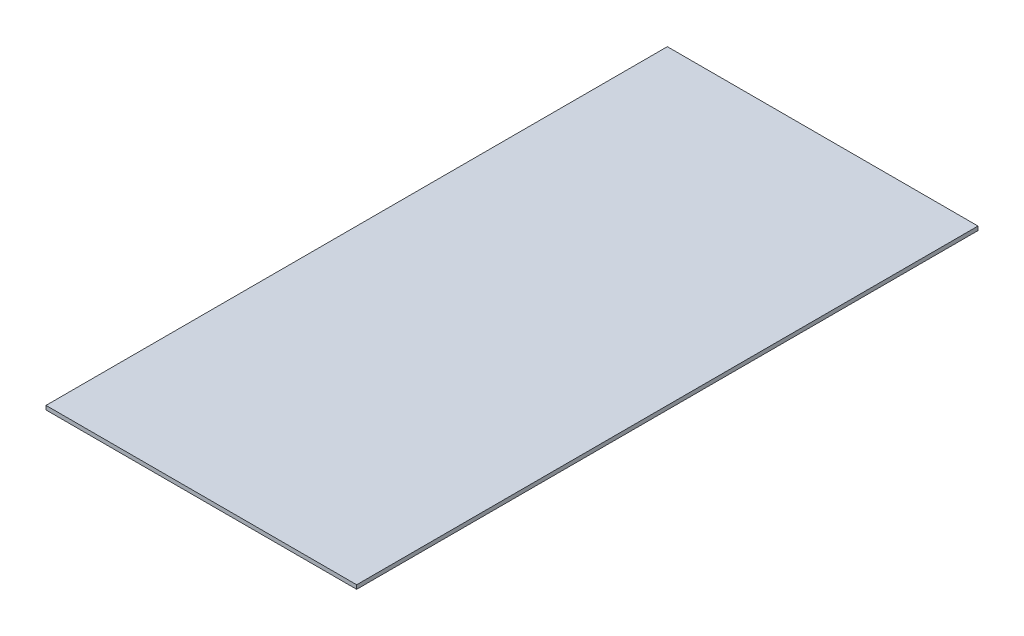
from build123d import *

# Parameters (mm, degrees)
SKETCH1_W           = 247.65
SKETCH1_H           = 495.3
BOSS_EXTRUDE1_DEPTH = 1.5875


with BuildPart() as part:
    # Sketch1 → Boss-Extrude1 (new, symmetric)
    with BuildSketch(Plane(origin=(0, 0, 0), x_dir=(1, 0, 0), z_dir=(0, 1, 0))):
        Rectangle(SKETCH1_W, SKETCH1_H)
    extrude(amount=BOSS_EXTRUDE1_DEPTH, both=True)


solid = part.part
